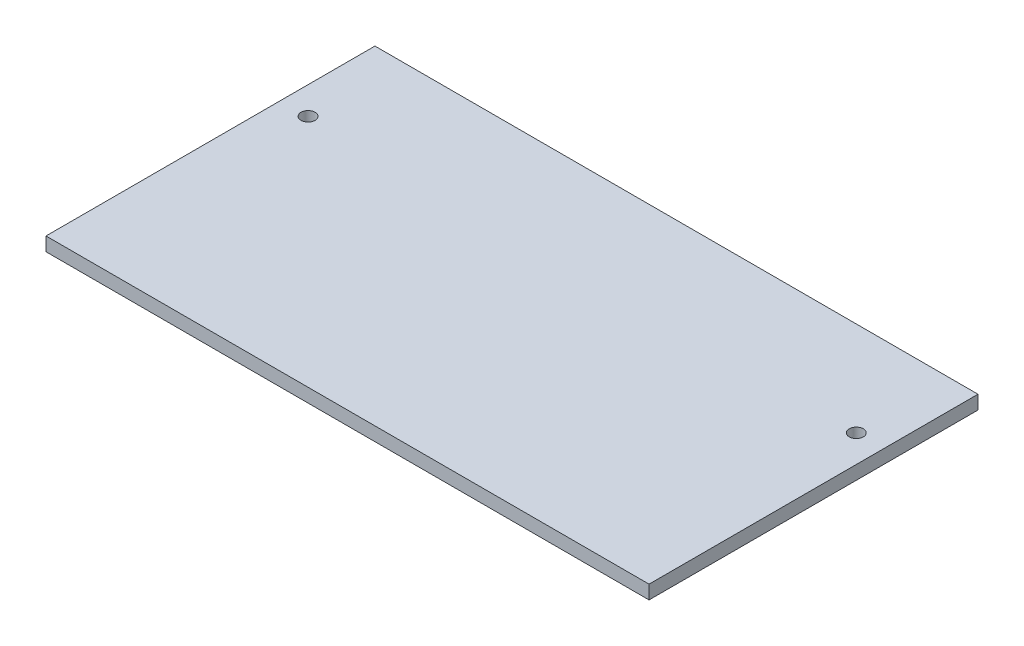
from build123d import *

# Parameters (mm, degrees)
SKETCH1_W                = 279.4
SKETCH1_H                = 152.4
BOSS_EXTRUDE1_DEPTH      = 6.35
F_0_257_DIAMETER_HOLE1_D = 6.5278


with BuildPart() as part:
    # Sketch1 → Boss-Extrude1 (new body)
    with BuildSketch(Plane(origin=(0, 0, 0), x_dir=(1, 0, 0), z_dir=(0, 1, 0))):
        Rectangle(SKETCH1_W, SKETCH1_H)
    extrude(amount=BOSS_EXTRUDE1_DEPTH)

    # F (0.257) Diameter Hole1 (through all)
    with Locations(Plane(origin=(0, 6.35, 0), x_dir=(1, 0, 0), z_dir=(0, 1, 0))):
        with Locations((-127, 32.512), (127, 32.512)):
            Hole(F_0_257_DIAMETER_HOLE1_D / 2)


solid = part.part
